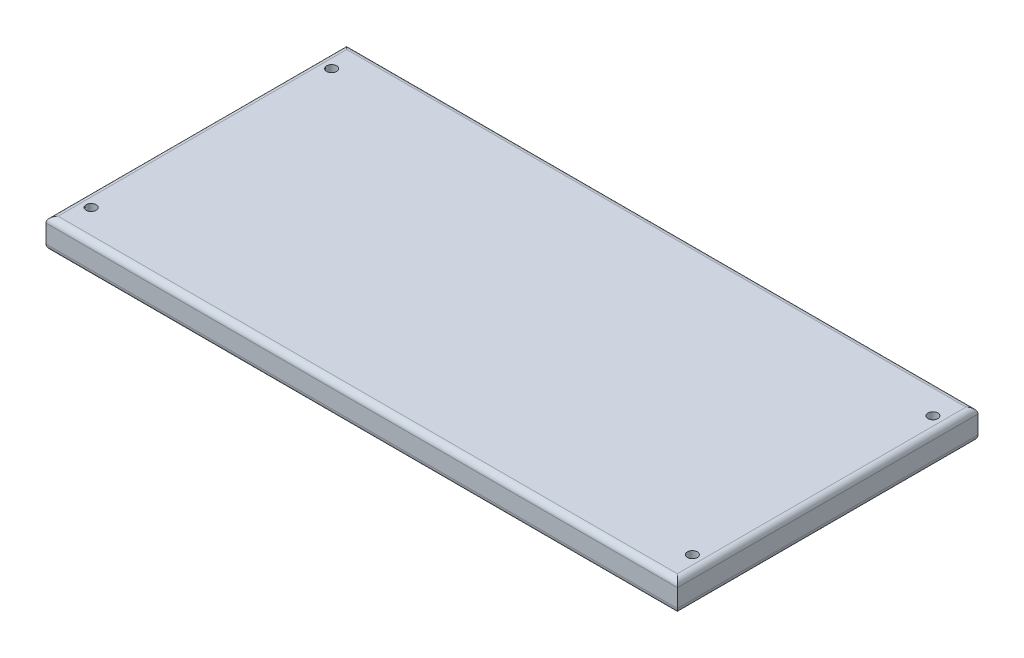
from build123d import *

# Parameters (mm, degrees)
SKETCH_1_W          = 210
SKETCH_1_H          = 100
EXTRUDE_1_DEPTH     = 10
FILLET_1_R          = 2
SKETCH_2_R          = 1.65
CUT_EXTRUDE_1_DEPTH = 233.808934536


with BuildPart() as part:
    # 草图1 → 凸台-拉伸1 (new body)
    with BuildSketch(Plane(origin=(0, 0, 0), x_dir=(1, 0, 0), z_dir=(0, 1, 0))):
        with Locations((-105, 50)):
            Rectangle(SKETCH_1_W, SKETCH_1_H)
    extrude(amount=EXTRUDE_1_DEPTH)

    # 圆角1
    fillet_1_edges = [part.edges().sort_by_distance(p)[0] for p in [
        (0, 10, -50),
        (-105, 10, -100),
        (-210, 10, -50),
        (-105, 0, -100),
        (0, 0, -50),
        (-105, 0, 0),
        (-210, 0, -50),
        (-105, 10, 0),
    ]]
    fillet(fillet_1_edges, radius=FILLET_1_R)

    # 草图2 → 切除-拉伸1 (cut, through all)
    with BuildSketch(Plane(origin=(0, 10, 0), x_dir=(1, 0, 0), z_dir=(0, 1, 0))):
        with Locations(Location((-205, 10, 0), (0, 0, 270))):
            Circle(SKETCH_2_R)
        with Locations(Location((-205, 90, 0), (0, 0, 270))):
            Circle(SKETCH_2_R)
        with Locations(Location((-5, 90, 0), (0, 0, 270))):
            Circle(SKETCH_2_R)
        with Locations(Location((-5, 10, 0), (0, 0, 270))):
            Circle(SKETCH_2_R)
    extrude(amount=-CUT_EXTRUDE_1_DEPTH, mode=Mode.SUBTRACT)


solid = part.part
